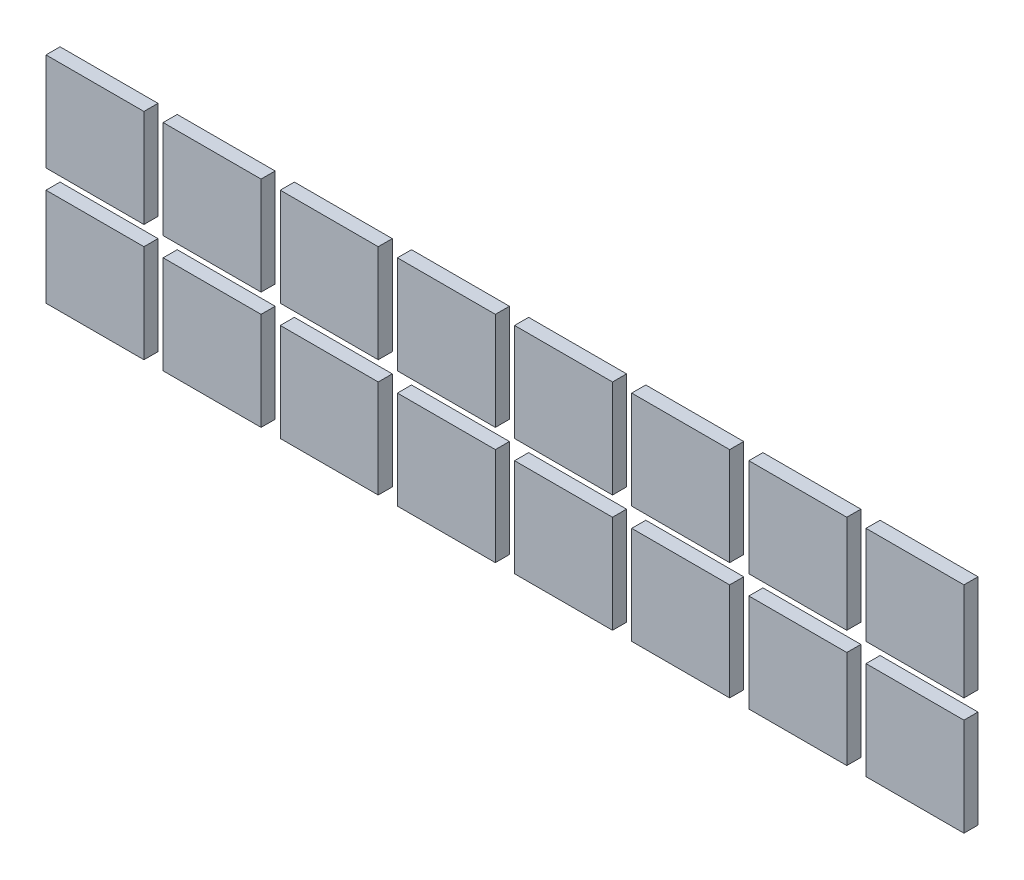
from build123d import *

# Parameters (mm, degrees)
SKETCH1_W           = 20.9
SKETCH1_H           = 20.9
BOSS_EXTRUDE1_DEPTH = 3
SKETCH2_R           = 7.56
CUT_EXTRUDE1_DEPTH  = 2
LPATTERN1_COUNT     = 8
LPATTERN1_PITCH     = 25
LPATTERN1_2_COUNT   = 2
LPATTERN1_2_PITCH   = 25


with BuildPart() as part:
    # Sketch1 → Boss-Extrude1 (new body)
    with BuildSketch(Plane(origin=(0, 0, 0), x_dir=(0, 1, 0), z_dir=(0, 0, 1))):
        with Locations((10.45, 10.45)):
            Rectangle(SKETCH1_W, SKETCH1_H)
    extrude(amount=BOSS_EXTRUDE1_DEPTH)

    # Sketch2 → Cut-Extrude1 (cut)
    with BuildSketch(Plane(origin=(0, 0, 0), x_dir=(1, 0, 0), z_dir=(0, 0, -1))):
        with Locations(Location((-10.45, -10.45, 0), (0, 0, 180))):
            Circle(SKETCH2_R)
    extrude(amount=-CUT_EXTRUDE1_DEPTH, mode=Mode.SUBTRACT)


with BuildPart() as lpattern1_1:
    # LPattern1: pattern copy
    add(part.part.moved(Location(Vector(-1, 0, 0) * (1 * LPATTERN1_PITCH))))


with BuildPart() as lpattern1_2:
    # LPattern1: pattern copy
    add(part.part.moved(Location(Vector(-1, 0, 0) * (2 * LPATTERN1_PITCH))))


with BuildPart() as lpattern1_3:
    # LPattern1: pattern copy
    add(part.part.moved(Location(Vector(-1, 0, 0) * (3 * LPATTERN1_PITCH))))


with BuildPart() as lpattern1_4:
    # LPattern1: pattern copy
    add(part.part.moved(Location(Vector(-1, 0, 0) * (4 * LPATTERN1_PITCH))))


with BuildPart() as lpattern1_5:
    # LPattern1: pattern copy
    add(part.part.moved(Location(Vector(-1, 0, 0) * (5 * LPATTERN1_PITCH))))


with BuildPart() as lpattern1_6:
    # LPattern1: pattern copy
    add(part.part.moved(Location(Vector(-1, 0, 0) * (6 * LPATTERN1_PITCH))))


with BuildPart() as lpattern1_7:
    # LPattern1: pattern copy
    add(part.part.moved(Location(Vector(-1, 0, 0) * (7 * LPATTERN1_PITCH))))


with BuildPart() as lpattern1_2_1:
    # LPattern1 2: pattern copy
    add(part.part.moved(Location(Vector(0, -1, 0) * (1 * LPATTERN1_2_PITCH))))


with BuildPart() as lpattern1_2_2:
    # LPattern1 2: pattern copy
    add(lpattern1_1.part.moved(Location(Vector(0, -1, 0) * (1 * LPATTERN1_2_PITCH))))


with BuildPart() as lpattern1_2_3:
    # LPattern1 2: pattern copy
    add(lpattern1_2.part.moved(Location(Vector(0, -1, 0) * (1 * LPATTERN1_2_PITCH))))


with BuildPart() as lpattern1_2_4:
    # LPattern1 2: pattern copy
    add(lpattern1_3.part.moved(Location(Vector(0, -1, 0) * (1 * LPATTERN1_2_PITCH))))


with BuildPart() as lpattern1_2_5:
    # LPattern1 2: pattern copy
    add(lpattern1_4.part.moved(Location(Vector(0, -1, 0) * (1 * LPATTERN1_2_PITCH))))


with BuildPart() as lpattern1_2_6:
    # LPattern1 2: pattern copy
    add(lpattern1_5.part.moved(Location(Vector(0, -1, 0) * (1 * LPATTERN1_2_PITCH))))


with BuildPart() as lpattern1_2_7:
    # LPattern1 2: pattern copy
    add(lpattern1_6.part.moved(Location(Vector(0, -1, 0) * (1 * LPATTERN1_2_PITCH))))


with BuildPart() as lpattern1_2_8:
    # LPattern1 2: pattern copy
    add(lpattern1_7.part.moved(Location(Vector(0, -1, 0) * (1 * LPATTERN1_2_PITCH))))


solid = Compound([part.part, lpattern1_1.part, lpattern1_2.part, lpattern1_3.part, lpattern1_4.part, lpattern1_5.part, lpattern1_6.part, lpattern1_7.part, lpattern1_2_1.part, lpattern1_2_2.part, lpattern1_2_3.part, lpattern1_2_4.part, lpattern1_2_5.part, lpattern1_2_6.part, lpattern1_2_7.part, lpattern1_2_8.part])
